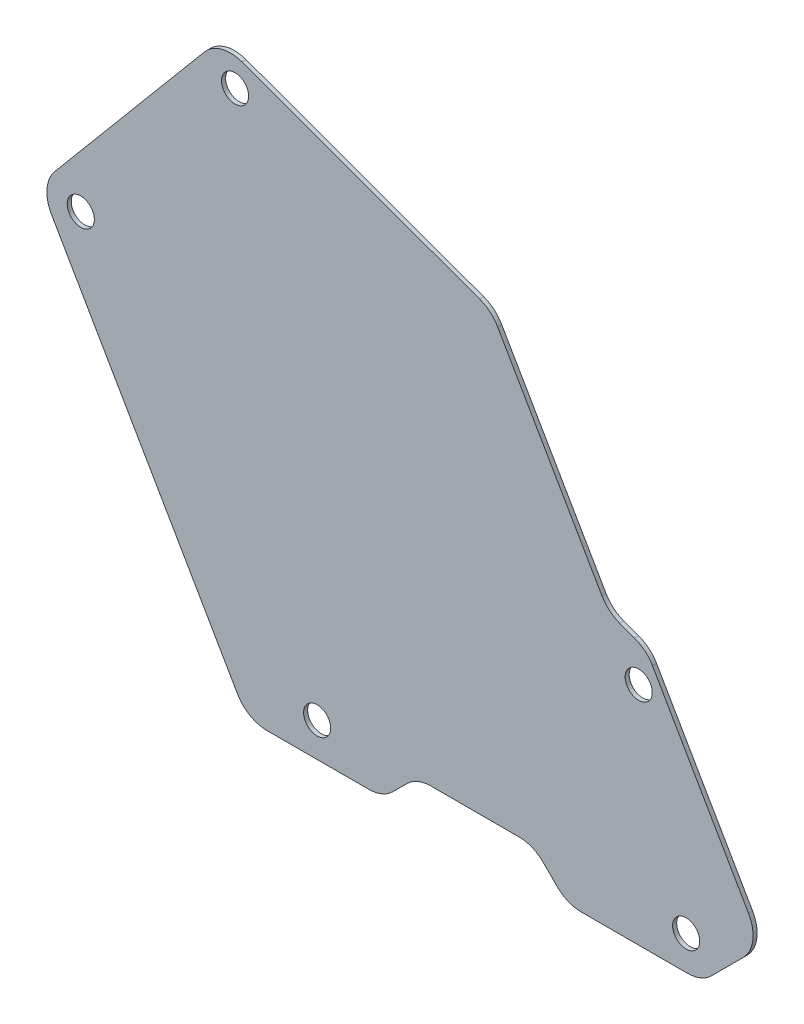
from build123d import *

# Parameters (mm, degrees)
RESSALTO_EXTRUS_O1_DEPTH = 3
FILETE1_R                = 25
ESBO_O2_R                = 10
CORTE_EXTRUS_O1_DEPTH    = 556.395887416


with BuildPart() as part:
    # Esboço1 → Ressalto-extrusão1 (new body)
    with BuildSketch(Plane.XY):
        Polygon((-18.228540014, 416.846731975), (-150, 259.807621135), (0, 0), (95, 0), (120, 25), (210, 25), (235, 0), (330, 0), (370, 40), (287.829512447, 182.323459324), (259.709984143, 192.558130628), (169.709984143, 348.44270331), align=None)
        Polygon((0, 0), (-150, 259.807621135), (-18.228540014, 416.846731975), (-23.228540014, 418.666583146), (-156.080645864, 260.339608715), (-2.886751346, -5), (97.071067812, -5), (122.071067812, 20), (207.928932188, 20), (232.928932188, -5), (332.071067812, -5), (376.248444489, 39.177376677), (291.249713881, 186.399496669), (263.130185576, 196.634167974), (177.019495143, 345.782258878), (169.709984143, 348.44270331), (259.709984143, 192.558130628), (287.829512447, 182.323459324), (370, 40), (330, 0), (235, 0), (210, 25), (120, 25), (95, 0), align=None)
    extrude(amount=RESSALTO_EXTRUS_O1_DEPTH)

    # Filete1
    filete1_edges = [part.edges().sort_by_distance(p)[0] for p in [
        (177.019495143, 345.782258878, 1.5),
        (263.130185576, 196.634167974, 1.5),
        (291.249713881, 186.399496669, 1.5),
        (376.248444489, 39.177376677, 1.5),
        (332.071067812, -5, 1.5),
        (232.928932188, -5, 1.5),
        (207.928932188, 20, 1.5),
        (122.071067812, 20, 1.5),
        (97.071067812, -5, 1.5),
        (-2.886751346, -5, 1.5),
        (-156.080645864, 260.339608715, 1.5),
        (-23.228540014, 418.666583146, 1.5),
    ]]
    fillet(filete1_edges, radius=FILETE1_R)

    # Esboço2 → Corte-extrusão1 (cut, through all)
    with BuildSketch(Plane(origin=(0, 0, 0), x_dir=(-1, 0, 0), z_dir=(0, 0, -1))):
        with Locations((11.909345747, 393.263177907)):
            Circle(ESBO_O2_R)
        with Locations((125.677416542, 257.679670815)):
            Circle(ESBO_O2_R)
        with Locations((-48.61042611, 20)):
            Circle(ESBO_O2_R)
        with Locations((-320.673846837, 20)):
            Circle(ESBO_O2_R)
        with Locations((-285.673846837, 161.319502665)):
            Circle(ESBO_O2_R)
    extrude(amount=-CORTE_EXTRUS_O1_DEPTH, mode=Mode.SUBTRACT)


solid = part.part
